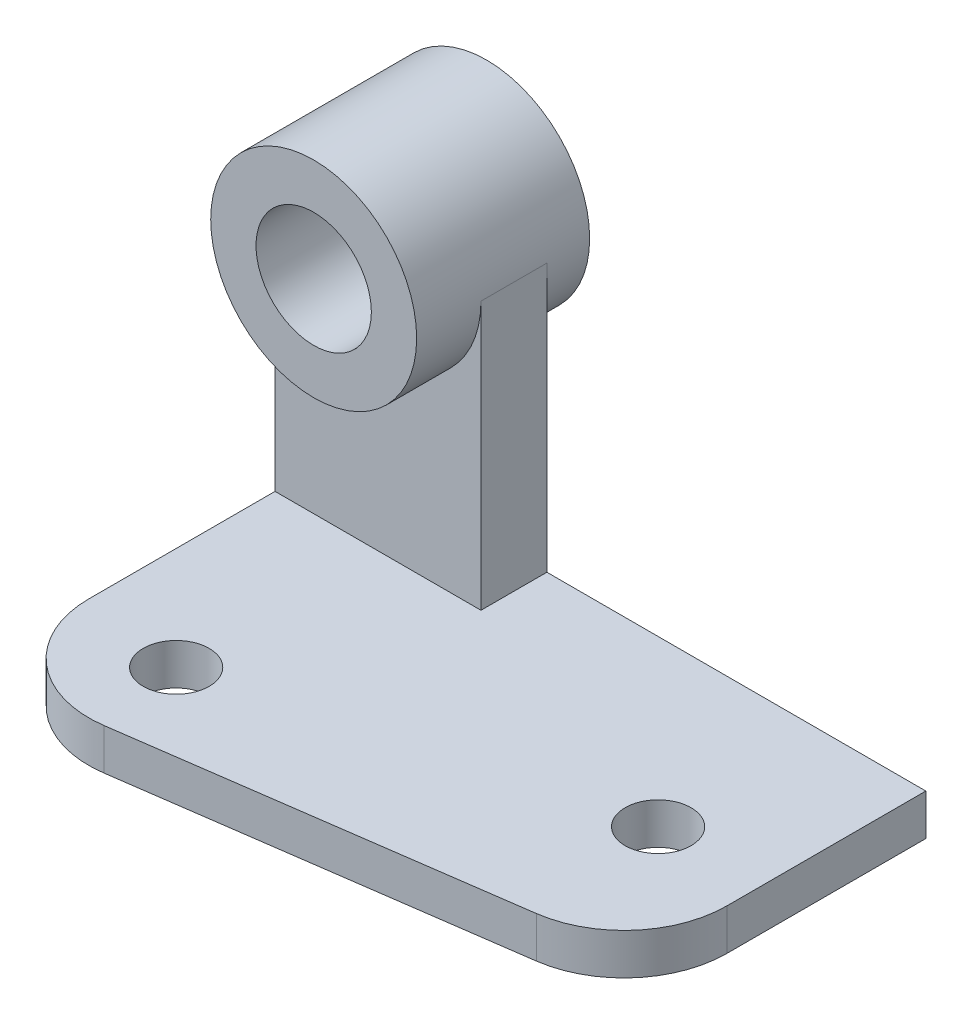
from build123d import *

# Parameters (mm, degrees)
SKETCH1_R                = 8
BOSS_EXTRUDE1_DEPTH      = 10
BOSS_EXTRUDE2_DEPTH      = 1
BOSS_EXTRUDE2_DEPTH_BACK = 41
SKETCH2_R                = 25
SKETCH2_R_2              = 14
BOSS_EXTRUDE3_DEPTH      = 16


with BuildPart() as part:
    # Sketch1 → Boss-Extrude1 (new body)
    with BuildSketch(Plane(origin=(0, 0, 0), x_dir=(1, 0, 0), z_dir=(0, 1, 0))):
        with BuildLine():
            Line((0, 30.616062134), (-71, 30.616062134))
            Line((-71, 30.616062134), (-71, -30.616062134))
            ThreePointArc((-71, -30.616062134), (-62.398661132, -49.486247959), (-42.513286954, -55.371724761))
            Line((-42.513286954, -55.371724761), (49.486713046, -42.413978282))
            ThreePointArc((49.486713046, -42.413978282), (64.870185825, -34.056976787), (71, -17.658315655))
            Line((71, -17.658315655), (71, 30.616062134))
            Line((71, 30.616062134), (0, 30.616062134))
        make_face()
        with Locations(Location((46, -9.383937866, 0), (0, 0, 270))):
            Circle(SKETCH1_R, mode=Mode.SUBTRACT)
        with Locations(Location((-46, -34.383937866, 0), (0, 0, 270))):
            Circle(SKETCH1_R, mode=Mode.SUBTRACT)
    extrude(amount=BOSS_EXTRUDE1_DEPTH)



with BuildPart() as body_2:
    # Sketch2 → Boss-Extrude2 (new, two sides: drawn at the far end of the back side and taken through both)
    with BuildSketch(Plane.XY.offset(-BOSS_EXTRUDE2_DEPTH_BACK)):
        with Locations((-46, 75)):
            Circle(SKETCH2_R)
        with Locations((-46, 75)):
            Circle(SKETCH2_R_2, mode=Mode.SUBTRACT)
    extrude(amount=BOSS_EXTRUDE2_DEPTH + BOSS_EXTRUDE2_DEPTH_BACK)


with BuildPart() as part_1:
    add(part.part)

    add(body_2.part)  # Boss-Extrude3 merges body 2
    # Sketch3 → Boss-Extrude3 (add)
    with BuildSketch(Plane(origin=(0, 0, -30.616062134), x_dir=(-1, 0, 0), z_dir=(0, 0, -1))):
        with BuildLine():
            Line((21, 10), (71, 10))
            Line((71, 10), (71, 75))
            ThreePointArc((71, 75), (46, 50), (21, 75))
            Line((21, 75), (21, 10))
        make_face()
    extrude(amount=-BOSS_EXTRUDE3_DEPTH)


solid = part_1.part
